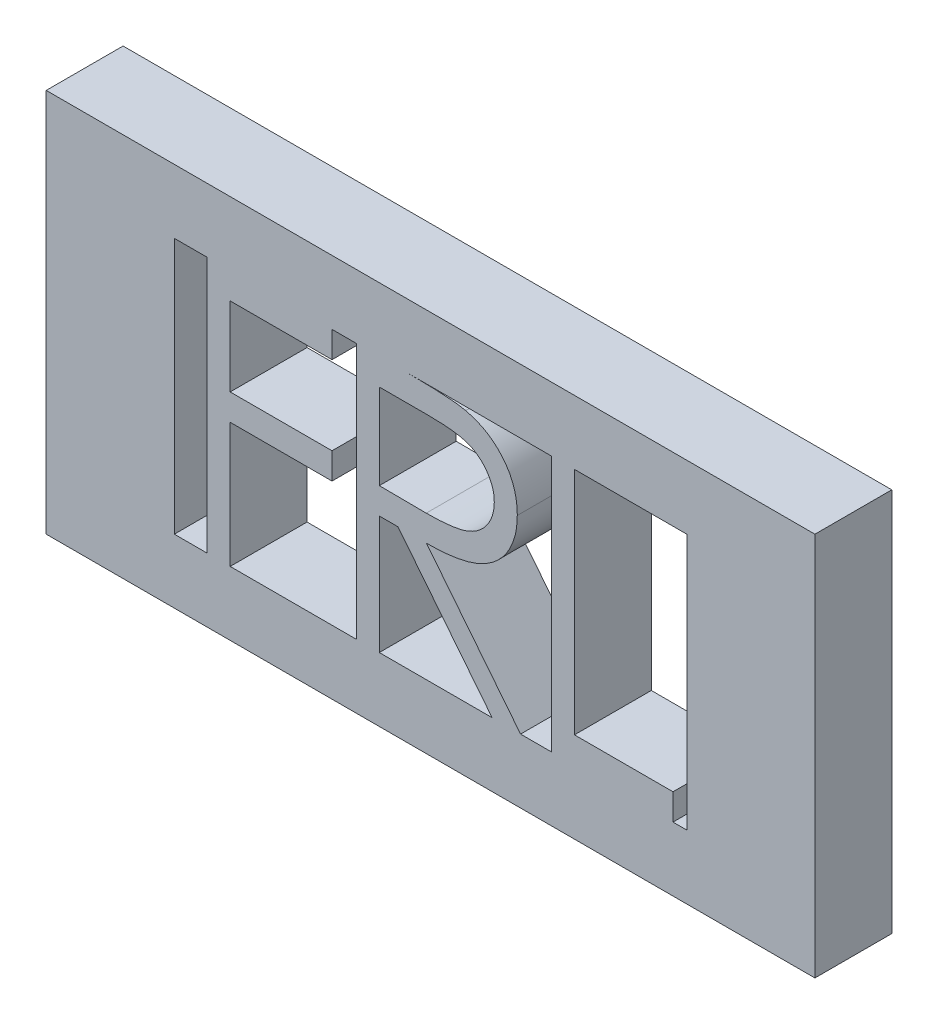
from build123d import *

# Parameters (mm, degrees)
SKETCH1_W           = 30
SKETCH1_H           = 15
BOSS_EXTRUDE1_DEPTH = 3
SKETCH2_W           = 20
SKETCH2_H           = 10
CUT_EXTRUDE1_DEPTH  = 18.036725037
BOSS_EXTRUDE2_DEPTH = 3


with BuildPart() as part:
    # Sketch1 → Boss-Extrude1 (new body)
    with BuildSketch(Plane.XY):
        Rectangle(SKETCH1_W, SKETCH1_H)
    extrude(amount=BOSS_EXTRUDE1_DEPTH)

    # Sketch2 → Cut-Extrude1 (cut, through all)
    with BuildSketch(Plane.XY.offset(3)):
        Rectangle(SKETCH2_W, SKETCH2_H)
    extrude(amount=-CUT_EXTRUDE1_DEPTH, mode=Mode.SUBTRACT)

    # Sketch3 → Boss-Extrude2 (add)
    # profile 1 of 3: a face of its own
    with BuildSketch(Plane.XY.offset(3)):
        Polygon((-8.717948718, 5), (-3.846153846, 5), (-3.846153846, 3.974358974), (-7.820512821, 3.974358974), (-7.820512821, 0.897435897), (-3.846153846, 0.897435897), (-3.846153846, -0.128205128), (-7.820512821, -0.128205128), (-7.820512821, -5), (-8.717948718, -5), align=None)
    # profile 2 of 3: a face of its own
    with BuildSketch(Plane.XY.offset(3)):
        with BuildLine():
            Line((-2.897435897, 5), (-0.896233974, 5))
            add(Edge.make_bspline(
                [(-0.896233974, 5), (-0.762687893, 4.999555469), (-0.506264623, 4.998701919), (-0.138912422, 4.993942596), (0.194879284, 4.98030158), (0.494935967, 4.96856277), (0.761252124, 4.947157224), (0.994644384, 4.926698232), (1.194037805, 4.899916344), (1.314740237, 4.875043707), (1.369391026, 4.863782051)],
                knots=[0, 0, 0, 0, 1.410062039, 2.707475311, 3.878576406, 4.937260626, 5.877586885, 6.699081471, 7.410979367, 8, 8, 8, 8], degree=3))
            add(Edge.make_bspline(
                [(1.369391026, 4.863782051), (1.442552809, 4.845705579), (1.587315636, 4.809938254), (1.795744396, 4.734339395), (1.99435675, 4.646854753), (2.182327677, 4.544101266), (2.358715652, 4.425316181), (2.525339397, 4.292550117), (2.682955006, 4.146529529), (2.825188236, 3.983572839), (2.959299812, 3.812611383), (3.072410173, 3.627743506), (3.169914401, 3.434424856), (3.24754445, 3.230689377), (3.310052945, 3.018512886), (3.354127915, 2.795973467), (3.38055988, 2.564084967), (3.383250895, 2.405919513), (3.384615385, 2.325721154)],
                knots=[0, 0, 0, 0, 1.027469482, 2.033020251, 3.019912614, 3.986113645, 4.951240523, 5.91722682, 6.890402269, 7.87763091, 8.8651537, 9.85103654, 10.82876324, 11.815024772, 12.821070561, 13.842952187, 14.906261191, 16, 16, 16, 16], degree=3))
            add(Edge.make_bspline(
                [(3.384615385, 2.325721154), (3.380418247, 2.192477998), (3.372228545, 1.93248609), (3.295871106, 1.555169286), (3.170795335, 1.203199815), (2.998443081, 0.87702085), (2.778958865, 0.582990434), (2.515173747, 0.324731991), (2.206940571, 0.108617955), (1.919999669, -0.041247202), (1.666530527, -0.137226941), (1.457863919, -0.204759394), (1.230243983, -0.256936438), (0.985851598, -0.303679672), (0.723669726, -0.338970227), (0.444326756, -0.36481764), (0.147623466, -0.380972065), (-0.056202447, -0.383377793), (-0.161057692, -0.384615385)],
                knots=[0, 0, 0, 0, 1.260483769, 2.459530307, 3.627416485, 4.787058657, 5.939039949, 7.08810263, 8.267026773, 9.491475466, 10.141966685, 10.831826277, 11.566392101, 12.351337768, 13.187381173, 14.07005841, 15.007169909, 16, 16, 16, 16], degree=3))
            Line((-0.161057692, -0.384615385), (3.512820513, -5))
            Line((3.512820513, -5), (2.403044872, -5))
            Line((2.403044872, -5), (-1.270833333, -0.384615385))
            Line((-1.270833333, -0.384615385), (-2, -0.384615385))
            Line((-2, -0.384615385), (-2, -5))
            Line((-2, -5), (-2.897435897, -5))
            Line((-2.897435897, -5), (-2.897435897, 5))
        make_face()
        with BuildLine():
            Line((-2, 3.974358974), (-2, 0.641025641))
            Line((-2, 0.641025641), (-0.169070513, 0.627003205))
            add(Edge.make_bspline(
                [(-0.169070513, 0.627003205), (-0.083584687, 0.626965386), (0.08211119, 0.626892082), (0.321827375, 0.638302871), (0.545027694, 0.651283781), (0.750858415, 0.671139054), (0.939411487, 0.69672783), (1.110592668, 0.728736356), (1.264681388, 0.766027964), (1.444391497, 0.823746895), (1.645067301, 0.915192661), (1.863157187, 1.048236943), (2.048878152, 1.215577284), (2.20578633, 1.406930015), (2.33187042, 1.617319298), (2.420762003, 1.84422321), (2.477168981, 2.08191349), (2.483821968, 2.245279512), (2.487179487, 2.327724359)],
                knots=[0, 0, 0, 0, 1.146690395, 2.22261258, 3.21895312, 4.145990853, 4.996080663, 5.770904154, 6.481378293, 7.121626537, 8.300444488, 9.431385265, 10.535395872, 11.636531494, 12.74115979, 13.810798291, 14.895190096, 16, 16, 16, 16], degree=3))
            add(Edge.make_bspline(
                [(2.487179487, 2.327724359), (2.483744855, 2.408143141), (2.476938669, 2.567503823), (2.421370759, 2.800806424), (2.327401098, 3.02099771), (2.200766132, 3.227181953), (2.046482832, 3.414341198), (1.865574796, 3.574475921), (1.662988524, 3.706617249), (1.473642243, 3.791058336), (1.304401636, 3.842829345), (1.15745975, 3.879261242), (0.991426957, 3.908531153), (0.805497075, 3.931982755), (0.600463844, 3.952139739), (0.375290555, 3.96571625), (0.131471183, 3.973755861), (-0.037520049, 3.974153258), (-0.125, 3.974358974)],
                knots=[0, 0, 0, 0, 1.101028733, 2.181837193, 3.264309656, 4.369019818, 5.486613113, 6.575447106, 7.666700264, 8.788928104, 9.402425223, 10.0903467, 10.862060571, 11.710948788, 12.657782767, 13.684531032, 14.801375019, 16, 16, 16, 16], degree=3))
            Line((-0.125, 3.974358974), (-2, 3.974358974))
        make_face(mode=Mode.SUBTRACT)
    # profile 3 of 3: a face of its own
    with BuildSketch(Plane.XY.offset(3)):
        Polygon((4.717948718, 5), (5.615384615, 5), (5.615384615, -3.974358974), (9.461538462, -3.974358974), (9.461538462, -5), (4.717948718, -5), align=None)
    extrude(amount=-BOSS_EXTRUDE2_DEPTH)


solid = part.part
